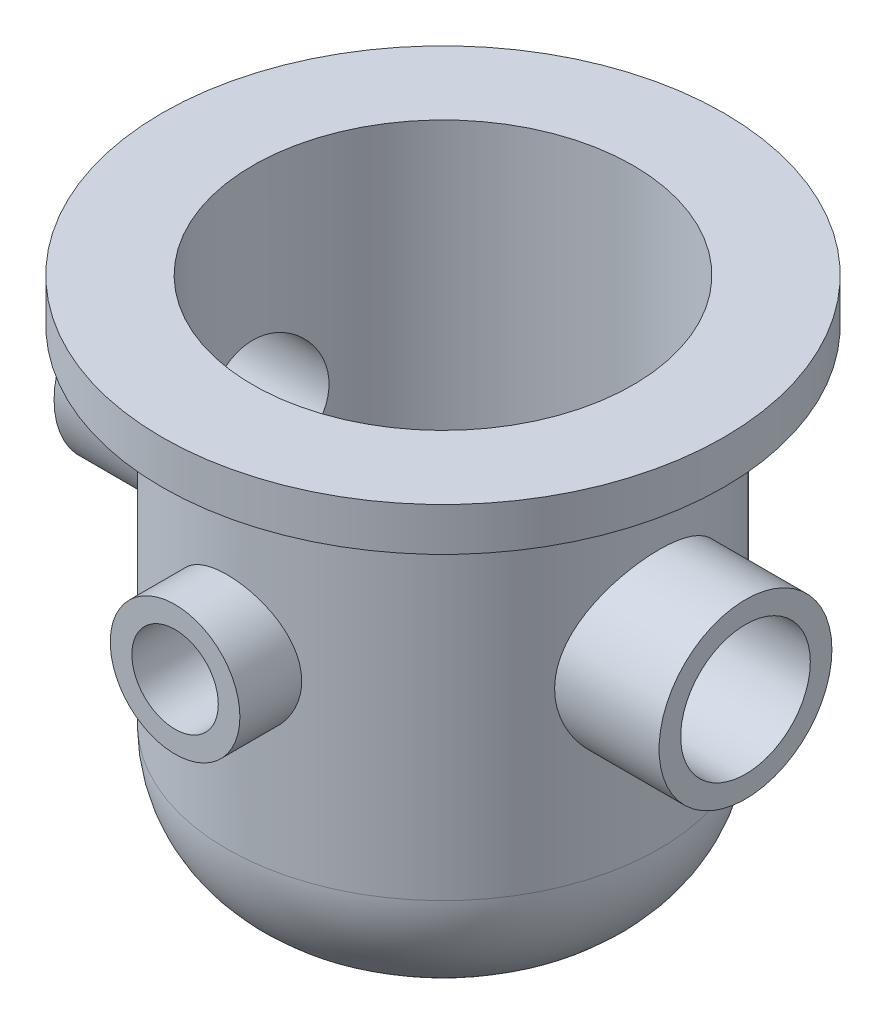
from build123d import *

# Parameters (mm, degrees)
BOSS_EXTRUDE1_REACH      = 123.897
BOSS_EXTRUDE1_END_RADIUS = 31.75
SKETCH2_R                = 12.7
CUT_EXTRUDE1_REACH       = 123.897
CUT_EXTRUDE1_END_RADIUS  = 27.94
SKETCH3_R                = 9.525
BOSS_EXTRUDE2_REACH      = 121.523
BOSS_EXTRUDE2_END_RADIUS = 31.75
SKETCH4_R                = 9.525
CUT_EXTRUDE2_REACH       = 121.523
CUT_EXTRUDE2_END_RADIUS  = 27.94
SKETCH5_R                = 6.35
SKETCH6_R                = 9.525
BOSS_EXTRUDE3_DEPTH      = 6.35
CUT_EXTRUDE3_REACH       = 104.44
SKETCH7_R                = 6.35


with BuildPart() as part:
    # Sketch1 → Revolve1 (revolve)
    with BuildSketch(Plane.XY, mode=Mode.PRIVATE) as revolve1_sk:
        with BuildLine():
            Line((-31.75, 69.85), (-31.75, 19.05))
            ThreePointArc((-31.75, 19.05), (-26.170384182, 5.579615818), (-12.7, 0))
            Line((-12.7, 0), (0, 0))
            Line((0, 0), (0, 3.81))
            Line((0, 3.81), (-12.7, 3.81))
            ThreePointArc((-12.7, 3.81), (-23.476307345, 8.273692655), (-27.94, 19.05))
            Line((-27.94, 19.05), (-27.94, 76.2))
            Line((-27.94, 76.2), (-41.275, 76.2))
            Line((-41.275, 76.2), (-41.275, 69.85))
            Line((-41.275, 69.85), (-31.75, 69.85))
        make_face()
    revolve(revolve1_sk.sketch.rotate(Axis((0, 0, 0), (0, 1, 0)), 270), axis=Axis((0, 0, 0), (0, 1, 0)))

    # Boss-Extrude1: up to this cylinder (the profile starts outside it)
    boss_extrude1_end = Plane(origin=(0, 44.45, 0), z_dir=(0, -1, 0)) * Cylinder(BOSS_EXTRUDE1_END_RADIUS, 312.294, mode=Mode.PRIVATE)
    # Sketch2 → Boss-Extrude1 (add, up to the surface)
    with BuildSketch(Plane(origin=(44.45, 0, 0), x_dir=(0, 0, -1), z_dir=(1, 0, 0)), mode=Mode.PRIVATE) as boss_extrude1_sk1:
        with Locations((0, 44.45)):
            Circle(SKETCH2_R)
    boss_extrude1_tool1 = extrude(boss_extrude1_sk1.sketch, amount=-BOSS_EXTRUDE1_REACH, mode=Mode.PRIVATE) - boss_extrude1_end
    boss_extrude1 = boss_extrude1_tool1.solids().sort_by_distance((44.45, 44.45, 0))[0]
    add(boss_extrude1)

    # Cut-Extrude1: up to this cylinder (the profile starts outside it)
    cut_extrude1_end = Plane(origin=(0, 44.45, 0), z_dir=(0, -1, 0)) * Cylinder(CUT_EXTRUDE1_END_RADIUS, 304.674, mode=Mode.PRIVATE)
    # Sketch3 → Cut-Extrude1 (cut, up to the surface)
    with BuildSketch(Plane(origin=(44.45, 0, 0), x_dir=(0, 0, -1), z_dir=(1, 0, 0)), mode=Mode.PRIVATE) as cut_extrude1_sk1:
        with Locations((0, 44.45)):
            Circle(SKETCH3_R)
    cut_extrude1_tool1 = extrude(cut_extrude1_sk1.sketch, amount=-CUT_EXTRUDE1_REACH, mode=Mode.PRIVATE) - cut_extrude1_end
    cut_extrude1 = cut_extrude1_tool1.solids().sort_by_distance((44.45, 44.45, 0))[0]
    add(cut_extrude1, mode=Mode.SUBTRACT)

    # Mirror3: Boss-Extrude1, Cut-Extrude1 across plane
    add(boss_extrude1.mirror(Plane(origin=(0, 0, 0), x_dir=(0, 0, 1), z_dir=(1, 0, 0))))
    add(cut_extrude1.mirror(Plane(origin=(0, 0, 0), x_dir=(0, 0, 1), z_dir=(1, 0, 0))), mode=Mode.SUBTRACT)

    # Boss-Extrude2: up to this cylinder (the profile starts outside it)
    boss_extrude2_end = Plane(origin=(0, 44.45, 0), z_dir=(0, -1, 0)) * Cylinder(BOSS_EXTRUDE2_END_RADIUS, 307.546, mode=Mode.PRIVATE)
    # Sketch4 → Boss-Extrude2 (add, up to the surface)
    with BuildSketch(Plane.XY.offset(39.37), mode=Mode.PRIVATE) as boss_extrude2_sk1:
        with Locations((0, 44.45)):
            Circle(SKETCH4_R)
    boss_extrude2_tool1 = extrude(boss_extrude2_sk1.sketch, amount=-BOSS_EXTRUDE2_REACH, mode=Mode.PRIVATE) - boss_extrude2_end
    add(boss_extrude2_tool1.solids().sort_by_distance((0, 44.45, 39.37))[0])

    # Cut-Extrude2: up to this cylinder (the profile starts outside it)
    cut_extrude2_end = Plane(origin=(0, 44.45, 0), z_dir=(0, -1, 0)) * Cylinder(CUT_EXTRUDE2_END_RADIUS, 299.926, mode=Mode.PRIVATE)
    # Sketch5 → Cut-Extrude2 (cut, up to the surface)
    with BuildSketch(Plane.XY.offset(39.37), mode=Mode.PRIVATE) as cut_extrude2_sk1:
        with Locations((0, 44.45)):
            Circle(SKETCH5_R)
    cut_extrude2_tool1 = extrude(cut_extrude2_sk1.sketch, amount=-CUT_EXTRUDE2_REACH, mode=Mode.PRIVATE) - cut_extrude2_end
    add(cut_extrude2_tool1.solids().sort_by_distance((0, 44.45, 39.37))[0], mode=Mode.SUBTRACT)

    # Sketch6 → Boss-Extrude3 (add)
    with BuildSketch(Plane.XZ):
        with Locations(Location((0, 0, 0), (0, 0, 90))):
            Circle(SKETCH6_R)
    extrude(amount=BOSS_EXTRUDE3_DEPTH)

    # Sketch7 → Cut-Extrude3 (cut, up to next)
    with BuildSketch(Plane.XZ.offset(6.35), mode=Mode.PRIVATE) as cut_extrude3_sk1:
        with Locations(Location((0, 0, 0), (0, 0, 270))):
            Circle(SKETCH7_R)
    cut_extrude3_tool1 = extrude(cut_extrude3_sk1.sketch, amount=-CUT_EXTRUDE3_REACH, mode=Mode.PRIVATE) & part.part
    add(cut_extrude3_tool1.solids().sort_by_distance((0, -6.35, 0))[0], mode=Mode.SUBTRACT)


solid = part.part
